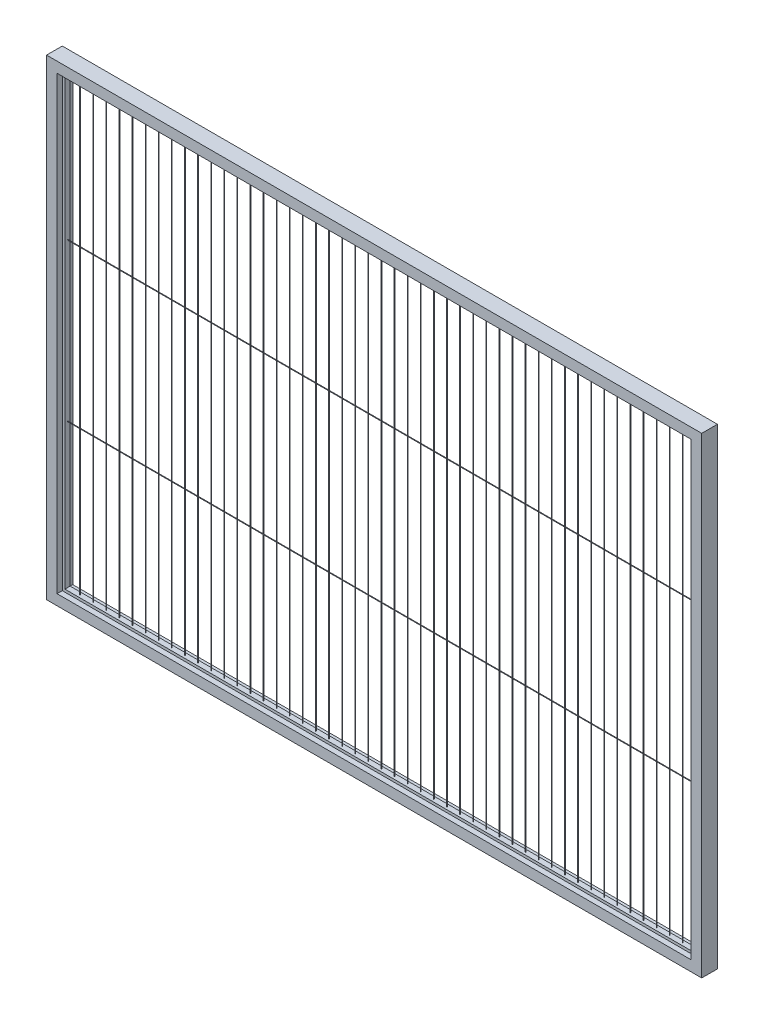
from build123d import *

# Parameters (mm, degrees)
EXTRUDE_1_DEPTH        = 1250
EXTRUDE_1_2_DEPTH      = 1250
EXTRUDE_2_DEPTH        = 1720
EXTRUDE_2_2_DEPTH      = 1720
SKETCH_4_W             = 50
SKETCH_4_H             = 60
CUT_EXTRUDE_1_DEPTH    = 10
SKETCH_5_W             = 50
SKETCH_5_H             = 60
CUT_EXTRUDE_2_DEPTH    = 10
SKETCH_6_R             = 1
EXTRUDE_3_DEPTH        = 2400
PATTERN_LINEAR_1_COUNT = 2
PATTERN_LINEAR_1_PITCH = 600
SKETCH_8_R             = 1
EXTRUDE_4_DEPTH        = 1700
PATTERN_LINEAR_2_COUNT = 48
PATTERN_LINEAR_2_PITCH = 50


with BuildPart() as part:
    # 草图1 → 凸台-拉伸1 (new, symmetric)
    with BuildSketch(Plane(origin=(0, 0, 0), x_dir=(0, 0, -1), z_dir=(1, 0, 0))):
        Polygon((30, 0), (-30, 0), (-30, 40), (-10, 40), (-10, 50), (10, 50), (10, 40), (30, 40), align=None)
    extrude(amount=EXTRUDE_1_DEPTH, both=True)

    # 草图5 → 切除-拉伸2 (cut)
    with BuildSketch(Plane(origin=(0, 40, 0), x_dir=(1, 0, 0), z_dir=(0, 1, 0))):
        with Locations((-1225, 0)):
            Rectangle(SKETCH_5_W, SKETCH_5_H)
        with Locations((1225, 0)):
            Rectangle(SKETCH_5_W, SKETCH_5_H)
    extrude(amount=CUT_EXTRUDE_2_DEPTH, mode=Mode.SUBTRACT)


with BuildPart() as body_2:
    # 草图1 → Extrude 1 2 (new, symmetric)
    with BuildSketch(Plane(origin=(0, 0, 0), x_dir=(0, 0, -1), z_dir=(1, 0, 0))):
        Polygon((30, 1800), (30, 1760), (10, 1760), (10, 1750), (-10, 1750), (-10, 1760), (-30, 1760), (-30, 1800), align=None)
    extrude(amount=EXTRUDE_1_2_DEPTH, both=True)

    # 草图4 → 切除-拉伸1 (cut)
    with BuildSketch(Plane.XZ.offset(-1760)):
        with Locations((-1225, 0)):
            Rectangle(SKETCH_4_W, SKETCH_4_H)
        with Locations((1225, 0)):
            Rectangle(SKETCH_4_W, SKETCH_4_H)
    extrude(amount=CUT_EXTRUDE_1_DEPTH, mode=Mode.SUBTRACT)



with BuildPart() as body_3:
    # 草图3 → 凸台-拉伸2 (new body)
    with BuildSketch(Plane.XZ.offset(-1760)):
        Polygon((-1250, -30), (-1250, 30), (-1210, 30), (-1210, 10), (-1200, 10), (-1200, -10), (-1210, -10), (-1210, -30), align=None)
    extrude(amount=EXTRUDE_2_DEPTH)



with BuildPart() as body_4:
    # 草图3 → Extrude 2 2 (new body)
    with BuildSketch(Plane.XZ.offset(-1760)):
        Polygon((1210, -30), (1250, -30), (1250, 30), (1210, 30), (1210, 10), (1200, 10), (1200, -10), (1210, -10), align=None)
    extrude(amount=EXTRUDE_2_2_DEPTH)


with BuildPart() as body_3_1:
    add(body_3.part)

    add(body_4.part)  # 凸台-拉伸3 merges body 4
    # 草图6 → 凸台-拉伸3 (add)
    with BuildSketch(Plane.ZY.offset(-1200)):
        with Locations(Location((0, 1200, 0), (0, 0, 180))):
            Circle(SKETCH_6_R)
    extrude_3 = extrude(amount=EXTRUDE_3_DEPTH)

    # 阵列(线性)1: 凸台-拉伸3 ×2
    with Locations(*[(0, -i * PATTERN_LINEAR_1_PITCH, 0) for i in range(1, PATTERN_LINEAR_1_COUNT)]):
        add(extrude_3)


with BuildPart() as body_2_1:
    add(body_2.part)

    add(body_3_1.part)  # 凸台-拉伸4 merges body 3
    # 草图8 → 凸台-拉伸4 (add)
    with BuildSketch(Plane.XZ.offset(-1750)):
        with Locations(Location((-1152, 0, 0), (0, 0, 90))):
            Circle(SKETCH_8_R)
    extrude_4 = extrude(amount=EXTRUDE_4_DEPTH)


with BuildPart() as part_1:
    add(part.part)

    add(body_2_1.part)  # 阵列(线性)2 merges body 2
    # 阵列(线性)2: 凸台-拉伸4 ×48
    with Locations(*[(i * PATTERN_LINEAR_2_PITCH, 0, 0) for i in range(1, PATTERN_LINEAR_2_COUNT)]):
        add(extrude_4)


solid = part_1.part
